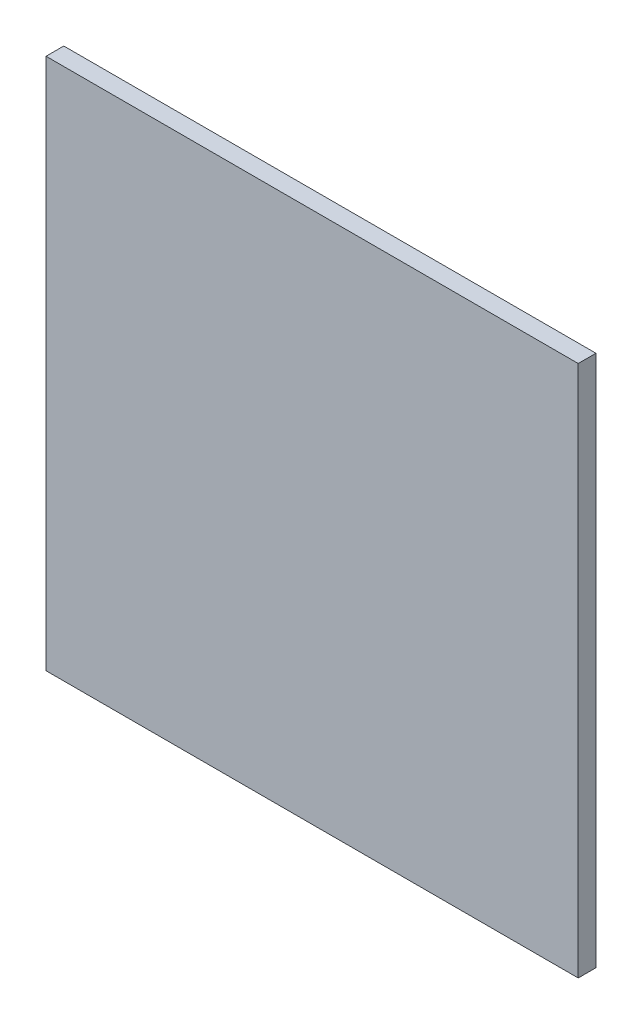
from build123d import *

# Parameters (mm, degrees)
SKETCH1_W           = 300
SKETCH1_H           = 300
BOSS_EXTRUDE1_DEPTH = 10


with BuildPart() as part:
    # Sketch1 → Boss-Extrude1 (new body)
    with BuildSketch(Plane.XY):
        with Locations((-1.104565538, -56.77466863)):
            Rectangle(SKETCH1_W, SKETCH1_H)
    extrude(amount=BOSS_EXTRUDE1_DEPTH)


solid = part.part
